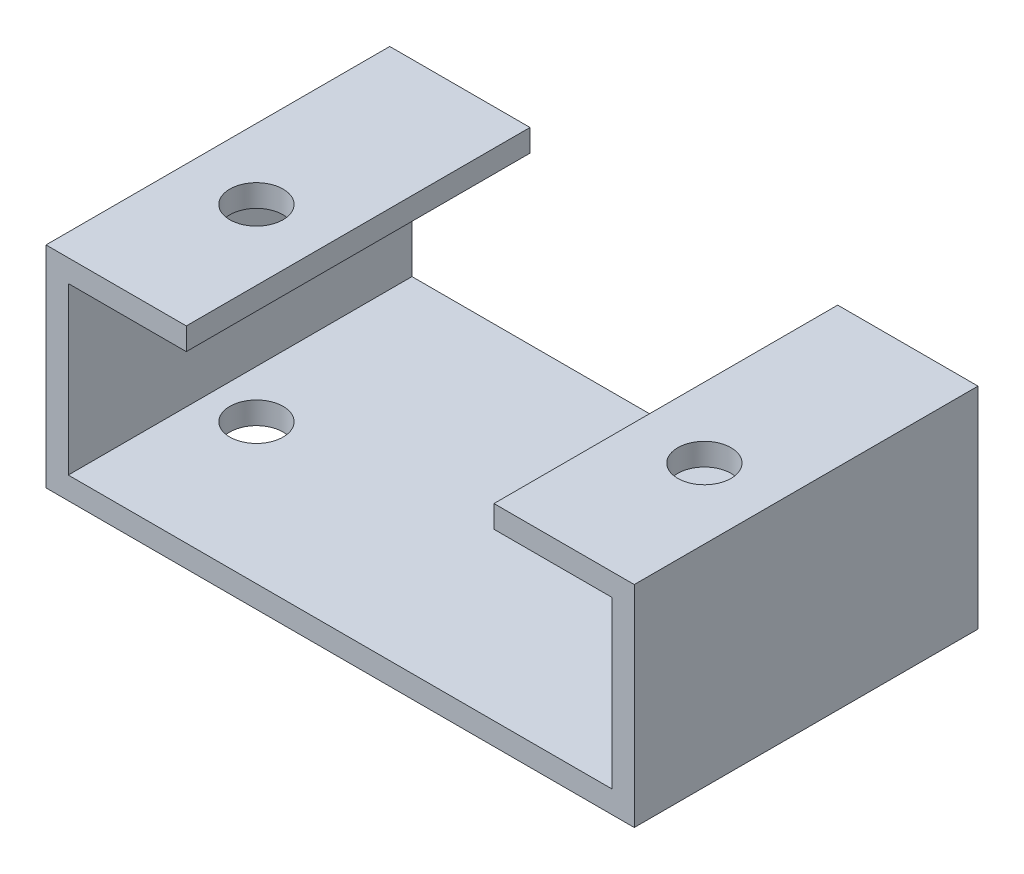
from build123d import *

# Parameters (mm, degrees)
BOSS_EXTRUDE1_START   = -14.5
BOSS_EXTRUDE1_DEPTH   = 24.5
F_6_CLEARANCE_HOLE1_D = 3.7973


with BuildPart() as part:
    # Sketch1 → Boss-Extrude1 (new body)
    with BuildSketch(Plane.XY.offset(BOSS_EXTRUDE1_START)):
        Polygon((20.965, 0), (0, 0), (0, 15), (10, 15), (10, 13.4125), (1.5875, 13.4125), (1.5875, 1.5875), (20.965, 1.5875), align=None)
    boss_extrude1 = extrude(amount=BOSS_EXTRUDE1_DEPTH)

    # #6 Clearance Hole1 (through all)
    with Locations(Plane(origin=(0, 0, 0), x_dir=(-1, 0, 0), z_dir=(0, -1, 0))):
        with Locations((-5, 0)):
            f_6_clearance_hole1 = Hole(F_6_CLEARANCE_HOLE1_D / 2)

    # Mirror1: Boss-Extrude1, #6 Clearance Hole1 across plane
    add(boss_extrude1.mirror(Plane(origin=(20.965, 1.5875, -14.5), x_dir=(0, 0, 1), z_dir=(1, 0, 0))))
    add(f_6_clearance_hole1.mirror(Plane(origin=(20.965, 1.5875, -14.5), x_dir=(0, 0, 1), z_dir=(1, 0, 0))), mode=Mode.SUBTRACT)


solid = part.part
